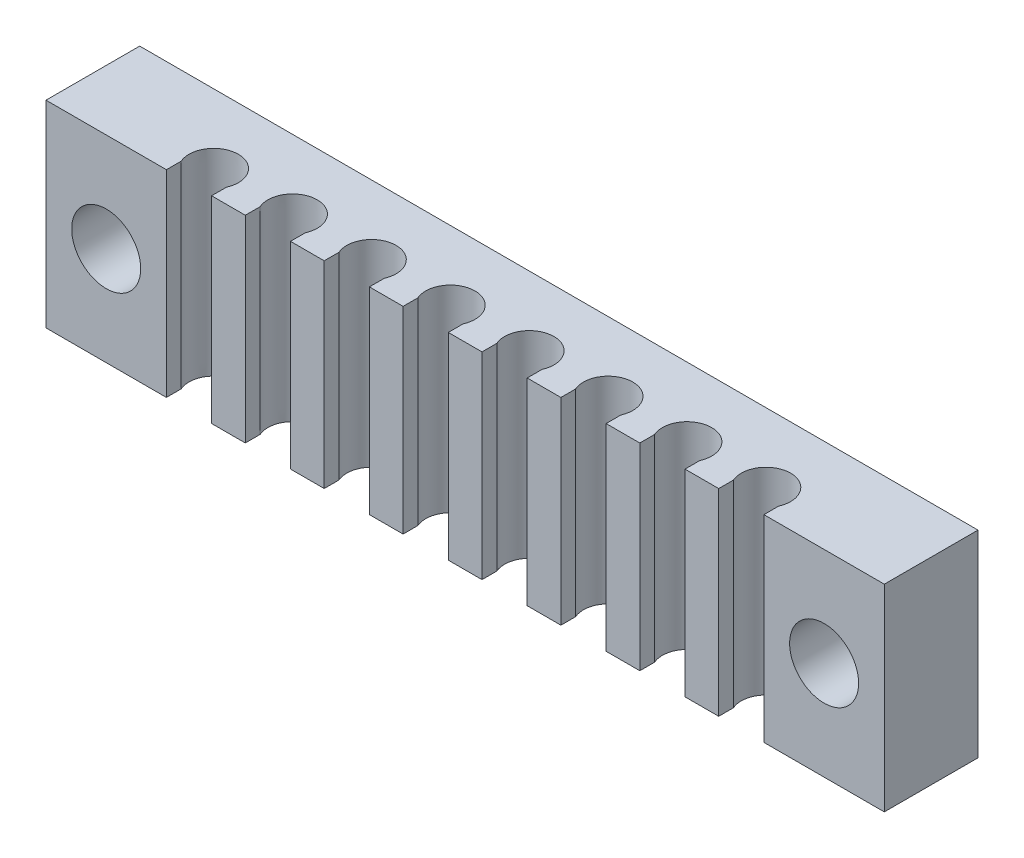
from build123d import *

# Parameters (mm, degrees)
BOSS_EXTRUDE1_DEPTH = 10
SKETCH4_R           = 1.75
CUT_EXTRUDE2_DEPTH  = 40.100031969


with BuildPart() as part:
    # Sketch1 → Boss-Extrude1 (new body)
    with BuildSketch(Plane(origin=(0, 0, 0), x_dir=(1, 0, 0), z_dir=(0, 1, 0))):
        with BuildLine():
            Line((-5, 4), (-5, -0.75))
            Line((-5, -0.75), (1.104356076, -0.75))
            Line((1.104356076, -0.75), (1.104356076, 0))
            ThreePointArc((1.104356076, 0), (2.25, 1.75), (3.395643924, 0))
            Line((3.395643924, 0), (3.395643924, -0.75))
            Line((3.395643924, -0.75), (5.104356076, -0.75))
            Line((5.104356076, -0.75), (5.104356076, 0))
            ThreePointArc((5.104356076, 0), (6.25, 1.75), (7.395643924, 0))
            Line((7.395643924, 0), (7.395643924, -0.75))
            Line((7.395643924, -0.75), (9.104356076, -0.75))
            Line((9.104356076, -0.75), (9.104356076, 0))
            ThreePointArc((9.104356076, 0), (10.25, 1.75), (11.395643924, 0))
            Line((11.395643924, 0), (11.395643924, -0.75))
            Line((11.395643924, -0.75), (13.104356076, -0.75))
            Line((13.104356076, -0.75), (13.104356076, 0))
            ThreePointArc((13.104356076, 0), (14.25, 1.75), (15.395643924, 0))
            Line((15.395643924, 0), (15.395643924, -0.75))
            Line((15.395643924, -0.75), (17.104356076, -0.75))
            Line((17.104356076, -0.75), (17.104356076, 0))
            ThreePointArc((17.104356076, 0), (18.25, 1.75), (19.395643924, 0))
            Line((19.395643924, 0), (19.395643924, -0.75))
            Line((19.395643924, -0.75), (21.104356076, -0.75))
            Line((21.104356076, -0.75), (21.104356076, 0))
            ThreePointArc((21.104356076, 0), (22.25, 1.75), (23.395643924, 0))
            Line((23.395643924, 0), (23.395643924, -0.75))
            Line((23.395643924, -0.75), (25.104356076, -0.75))
            Line((25.104356076, -0.75), (25.104356076, 0))
            ThreePointArc((25.104356076, 0), (26.25, 1.75), (27.395643924, 0))
            Line((27.395643924, 0), (27.395643924, -0.75))
            Line((27.395643924, -0.75), (29.104356076, -0.75))
            Line((29.104356076, -0.75), (29.104356076, 0))
            ThreePointArc((29.104356076, 0), (30.25, 1.75), (31.395643924, 0))
            Line((31.395643924, 0), (31.395643924, -0.75))
            Line((31.395643924, -0.75), (37.5, -0.75))
            Line((37.5, -0.75), (37.5, 4))
            Line((37.5, 4), (-5, 4))
        make_face()
    extrude(amount=BOSS_EXTRUDE1_DEPTH)

    # Sketch4 → Cut-Extrude2 (cut, through all)
    with BuildSketch(Plane.XY.offset(0.75)):
        with Locations((-1.947821962, 5)):
            Circle(SKETCH4_R)
        with Locations(Location((34.447821962, 5, 0), (0, 0, 180))):
            Circle(SKETCH4_R)
    extrude(amount=-CUT_EXTRUDE2_DEPTH, mode=Mode.SUBTRACT)


solid = part.part
